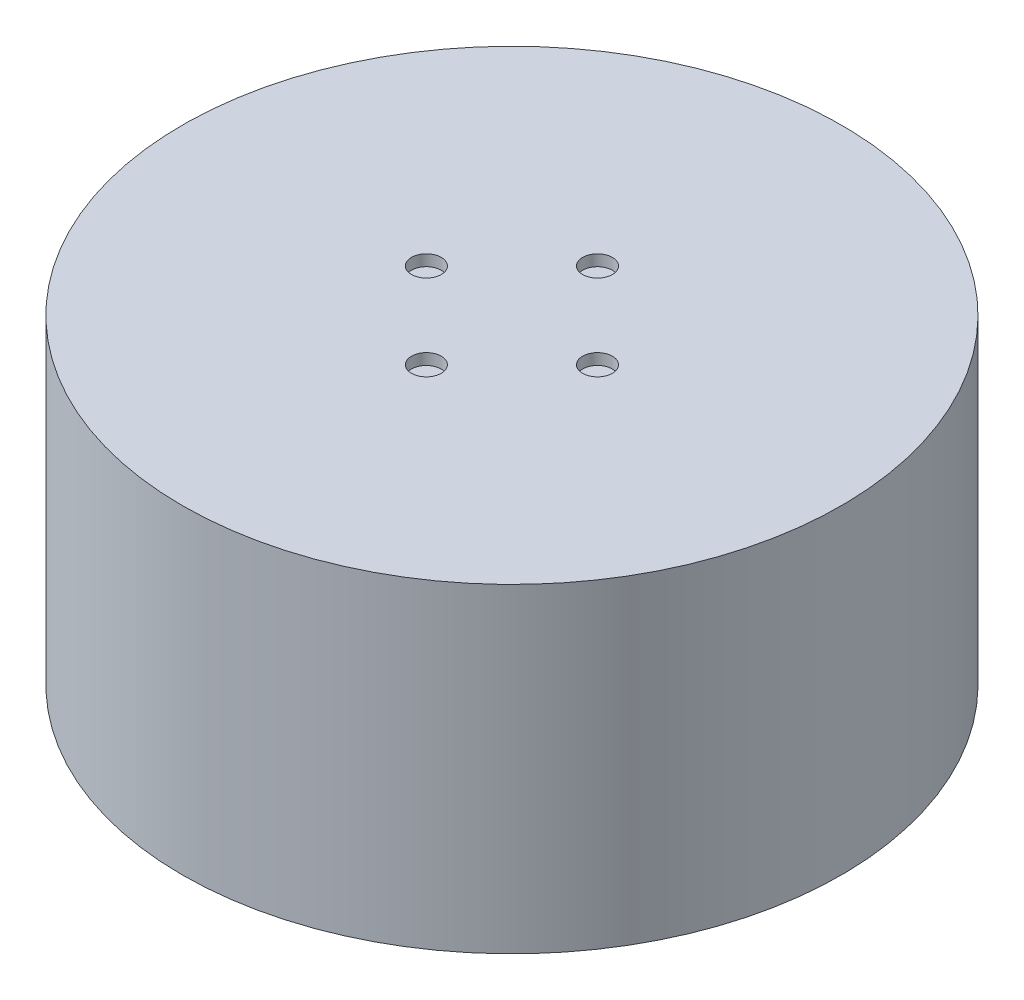
from build123d import *

# Parameters (mm, degrees)
SKETCH1_R           = 44.3
BOSS_EXTRUDE1_DEPTH = 43
SKETCH2_R           = 2
CUT_EXTRUDE1_DEPTH  = 1.5
BOSS_EXTRUDE2_DEPTH = 6
SKETCH4_R           = 2
CUT_EXTRUDE2_DEPTH  = 1.5


with BuildPart() as part:
    # Sketch1 → Boss-Extrude1 (new body)
    with BuildSketch(Plane(origin=(0, 0, 0), x_dir=(1, 0, 0), z_dir=(0, 1, 0))):
        with Locations(Location((0, 0, 0), (0, 0, 270))):
            Circle(SKETCH1_R)
    extrude(amount=BOSS_EXTRUDE1_DEPTH)

    # Sketch2 → Cut-Extrude1 (cut)
    with BuildSketch(Plane.XZ):
        with Locations(Location((0, 16, 0), (0, 0, 270))):
            Circle(SKETCH2_R)
        with Locations(Location((16, 0, 0), (0, 0, 270))):
            Circle(SKETCH2_R)
        with Locations(Location((0, -16, 0), (0, 0, 270))):
            Circle(SKETCH2_R)
        with Locations(Location((-16, 0, 0), (0, 0, 270))):
            Circle(SKETCH2_R)
    extrude(amount=-CUT_EXTRUDE1_DEPTH, mode=Mode.SUBTRACT)

    # Sketch3 → Boss-Extrude2 (add)
    with BuildSketch(Plane.XZ):
        with BuildLine():
            Line((19.798989873, 26.870057685), (26.870057685, 19.798989873))
            ThreePointArc((26.870057685, 19.798989873), (26.870057685, 15.556349186), (22.627416998, 15.556349186))
            Line((22.627416998, 15.556349186), (15.556349186, 22.627416998))
            ThreePointArc((15.556349186, 22.627416998), (15.556349186, 26.870057685), (19.798989873, 26.870057685))
        make_face()
    extrude(amount=BOSS_EXTRUDE2_DEPTH)

    # Sketch4 → Cut-Extrude2 (cut)
    with BuildSketch(Plane(origin=(0, 43, 0), x_dir=(1, 0, 0), z_dir=(0, 1, 0))):
        with Locations(Location((0, 11.5, 0), (0, 0, 270))):
            Circle(SKETCH4_R)
        with Locations(Location((11.5, 0, 0), (0, 0, 270))):
            Circle(SKETCH4_R)
        with Locations(Location((0, -11.5, 0), (0, 0, 270))):
            Circle(SKETCH4_R)
        with Locations(Location((-11.5, 0, 0), (0, 0, 270))):
            Circle(SKETCH4_R)
    extrude(amount=-CUT_EXTRUDE2_DEPTH, mode=Mode.SUBTRACT)


solid = part.part
